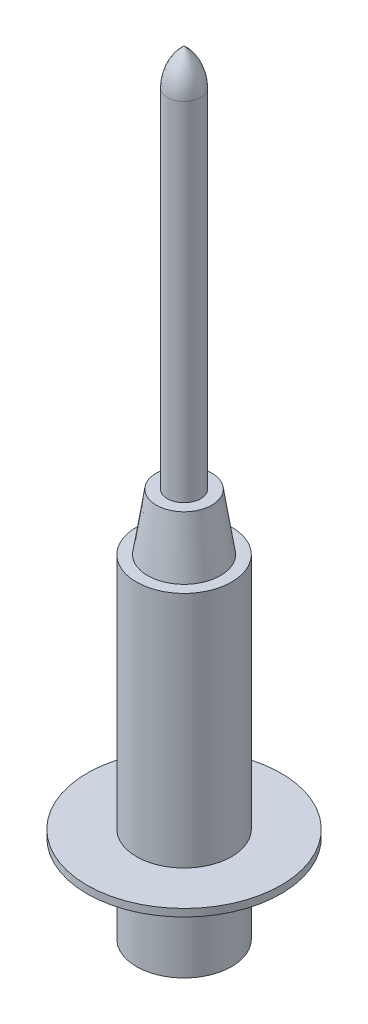
from build123d import *


with BuildPart() as part:
    # Sketch1 → Revolve1 (revolve)
    with BuildSketch(Plane.XY, mode=Mode.PRIVATE) as revolve1_sk:
        with BuildLine():
            Line((0, 0), (4.280585692, 0))
            Line((4.280585692, 0), (4.280585692, 7.9))
            Line((4.280585692, 7.9), (8.732864907, 7.9))
            Line((8.732864907, 7.9), (8.732864907, 8.57))
            Line((8.732864907, 8.57), (4.280585692, 8.57))
            Line((4.280585692, 8.57), (4.280585692, 29.97))
            Line((4.280585692, 29.97), (3.280585692, 29.97))
            Line((3.280585692, 29.97), (2.5, 35.07))
            Line((2.5, 35.07), (1.5, 35.07))
            Line((1.5, 35.07), (1.5, 66.323834281))
            ThreePointArc((1.5, 66.323834281), (1.107157772, 68.124815809), (0, 69.598607228))
            Line((0, 69.598607228), (0, 0))
        make_face()
    revolve(revolve1_sk.sketch.rotate(Axis((0, 69.598607228, 0), (0, -1, 0)), 90), axis=Axis((0, 69.598607228, 0), (0, -1, 0)))


solid = part.part
